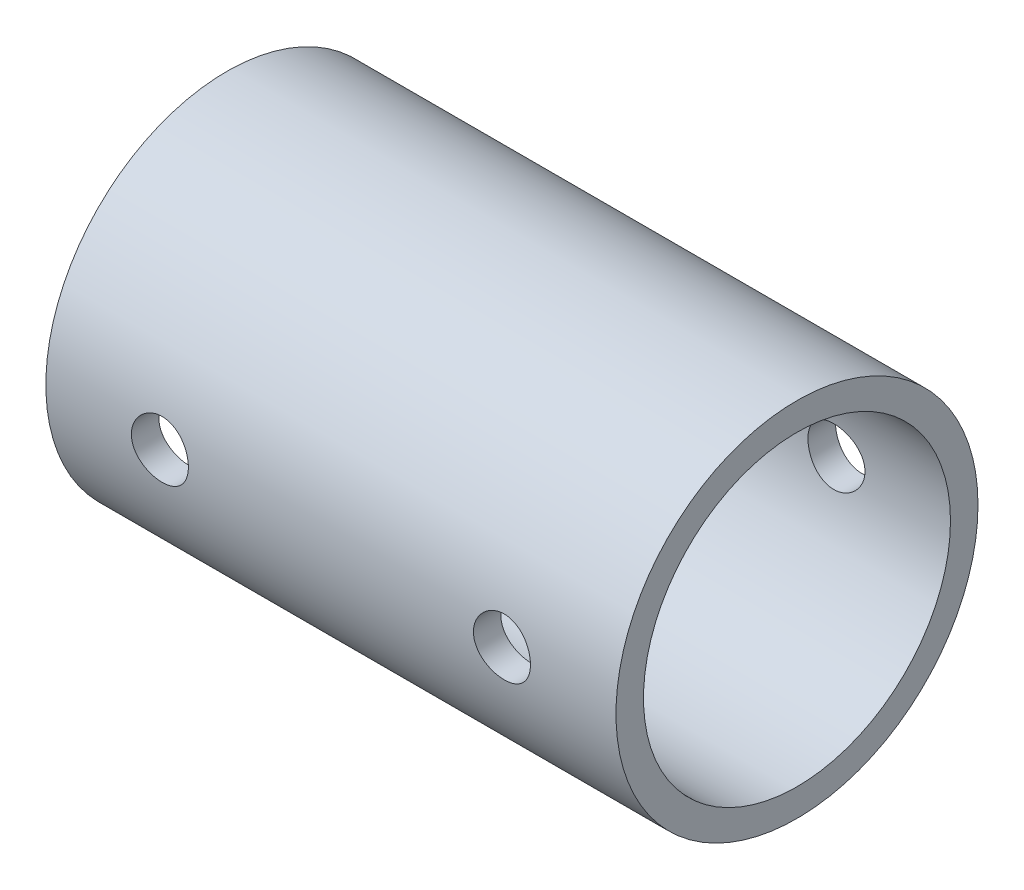
from build123d import *

# Parameters (mm, degrees)
BOSS_EXTRUDE1_DEPTH      = 25
BOSS_EXTRUDE1_DEPTH_BACK = 25
SKETCH1_R                = 15.875
SKETCH1_R_2              = 13.462
CUT_EXTRUDE1_DEPTH       = 25
CUT_EXTRUDE1_DEPTH_BACK  = 25
SKETCH2_R                = 2.5


with BuildPart() as part:
    # Sketch1 → Boss-Extrude1 (new, two sides: drawn at the far end of the back side and taken through both)
    with BuildSketch(Plane(origin=(0, 0, 0), x_dir=(0, 0, -1), z_dir=(1, 0, 0)).offset(-BOSS_EXTRUDE1_DEPTH_BACK)):
        Circle(SKETCH1_R)
        Circle(SKETCH1_R_2, mode=Mode.SUBTRACT)
    extrude(amount=BOSS_EXTRUDE1_DEPTH + BOSS_EXTRUDE1_DEPTH_BACK)

    # Sketch2 → Cut-Extrude1 (cut, two sides: drawn at the far end of the back side and taken through both)
    with BuildSketch(Plane.XY.offset(-CUT_EXTRUDE1_DEPTH_BACK)):
        with Locations((-15, 0)):
            Circle(SKETCH2_R)
        with Locations((15, 0)):
            Circle(SKETCH2_R)
    extrude(amount=CUT_EXTRUDE1_DEPTH + CUT_EXTRUDE1_DEPTH_BACK, mode=Mode.SUBTRACT)


solid = part.part
